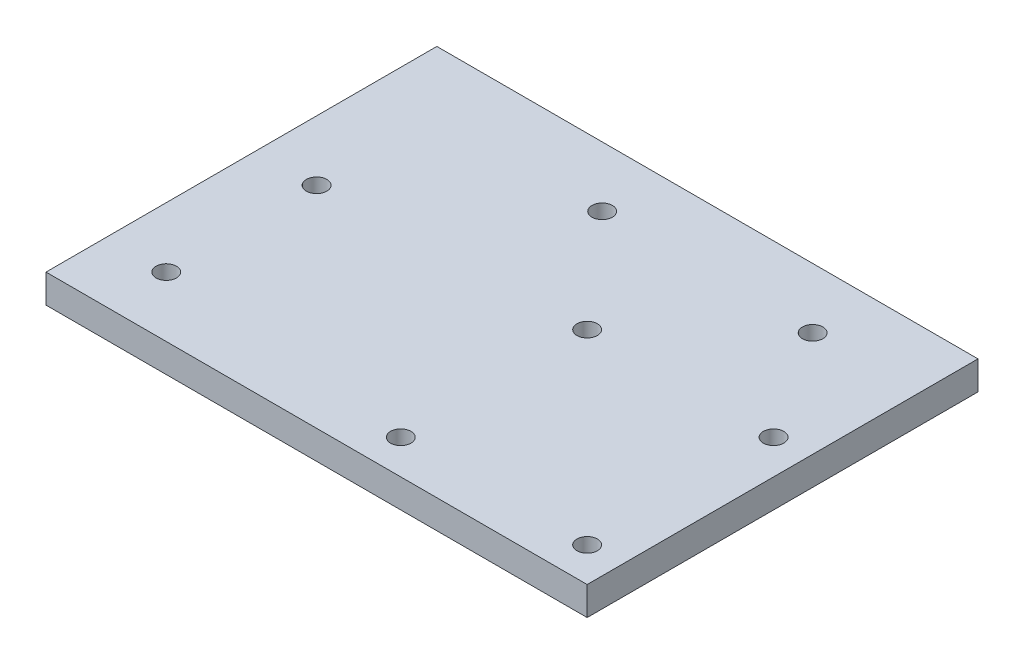
from build123d import *

# Parameters (mm, degrees)
SKETCH1_W            = 90
SKETCH1_H            = 65
BOSS_EXTRUDE1_DEPTH  = 4.7625
M3_CLEARANCE_HOLE1_D = 3.4
M3_CLEARANCE_HOLE2_D = 3.4


with BuildPart() as part:
    # Sketch1 → Boss-Extrude1 (new body)
    with BuildSketch(Plane(origin=(0, 0, 0), x_dir=(1, 0, 0), z_dir=(0, 1, 0))):
        with Locations((45, 32.5)):
            Rectangle(SKETCH1_W, SKETCH1_H)
    extrude(amount=BOSS_EXTRUDE1_DEPTH)

    # M3 Clearance Hole1 (through all)
    with Locations(Plane(origin=(0, 4.7625, 0), x_dir=(1, 0, 0), z_dir=(0, 1, 0))):
        with Locations((84.291, 5.709), (84.291, 36.709), (53.291, 36.709), (53.291, 5.709)):
            Hole(M3_CLEARANCE_HOLE1_D / 2)

    # M3 Clearance Hole2 (through all)
    with Locations(Plane(origin=(0, 0, 0), x_dir=(-1, 0, 0), z_dir=(0, -1, 0))):
        with Locations((-37.5, 55), (-72.5, 55), (-10, 35), (-10, 10)):
            Hole(M3_CLEARANCE_HOLE2_D / 2)


solid = part.part
